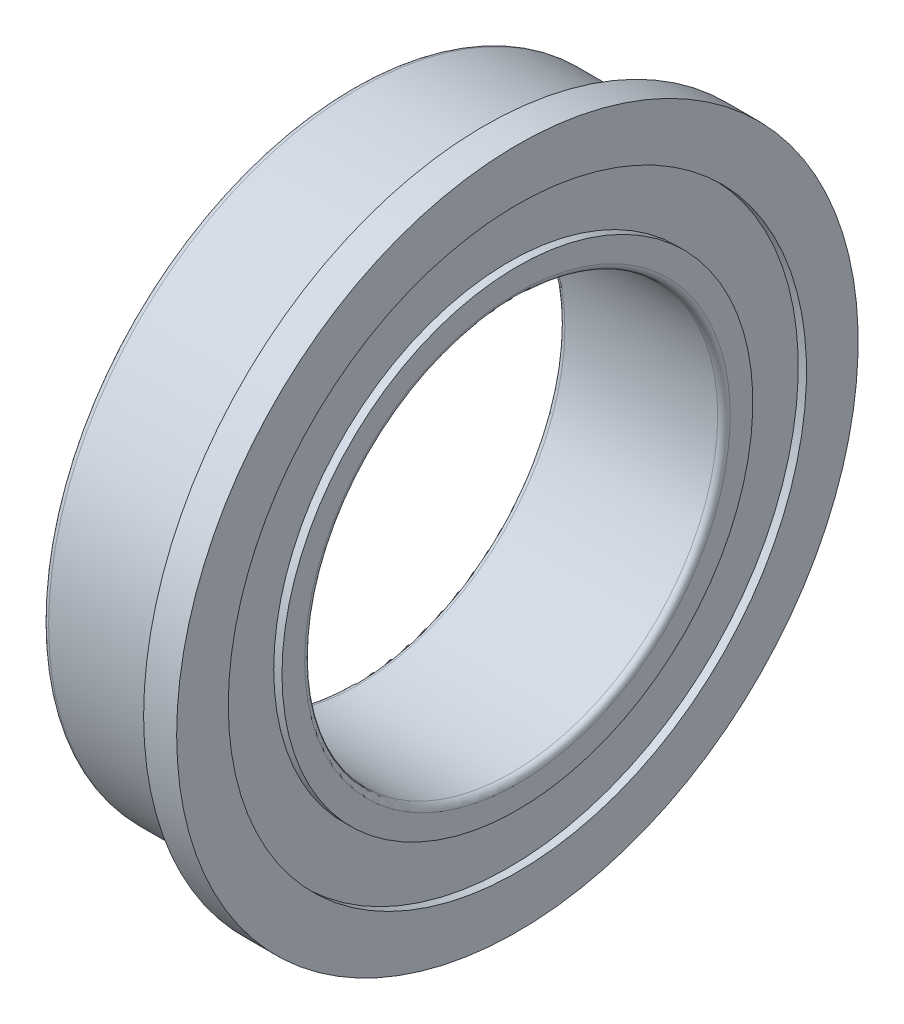
from build123d import *

# Parameters (mm, degrees)
FILLET1_R = 0.15


with BuildPart() as part:
    # Sketch1 → Revolve1 (revolve)
    with BuildSketch(Plane.XY, mode=Mode.PRIVATE) as revolve1_sk:
        with BuildLine():
            Line((0, 7.7), (0, 8.25))
            Line((0, 8.25), (0.8, 8.25))
            Line((0.8, 8.25), (0.8, 7))
            Line((0.8, 7), (0.6, 7))
            Line((0.6, 7), (0.6, 5.7))
            Line((0.6, 5.7), (0.8, 5.7))
            Line((0.8, 5.7), (0.8, 5))
            Line((0.8, 5), (-3.2, 5))
            Line((-3.2, 5), (-3.2, 5.7))
            Line((-3.2, 5.7), (-3, 5.7))
            Line((-3, 5.7), (-3, 7))
            Line((-3, 7), (-3.2, 7))
            Line((-3.2, 7), (-3.2, 7.5))
            Line((-3.2, 7.5), (-0.2, 7.5))
            ThreePointArc((-0.2, 7.5), (0.141421356, 7.358578644), (0, 7.7))
        make_face()
    revolve(revolve1_sk.sketch.rotate(Axis((-3.2, 0, 0), (1, 0, 0)), 90), axis=Axis((-3.2, 0, 0), (1, 0, 0)))

    # Fillet1
    fillet1_edges = [part.edges().sort_by_distance(p)[0] for p in [
        (0.8, 0, -5),
        (-3.2, 0, -5),
        (-3.2, 0, -7.5),
    ]]
    fillet(fillet1_edges, radius=FILLET1_R)


solid = part.part
